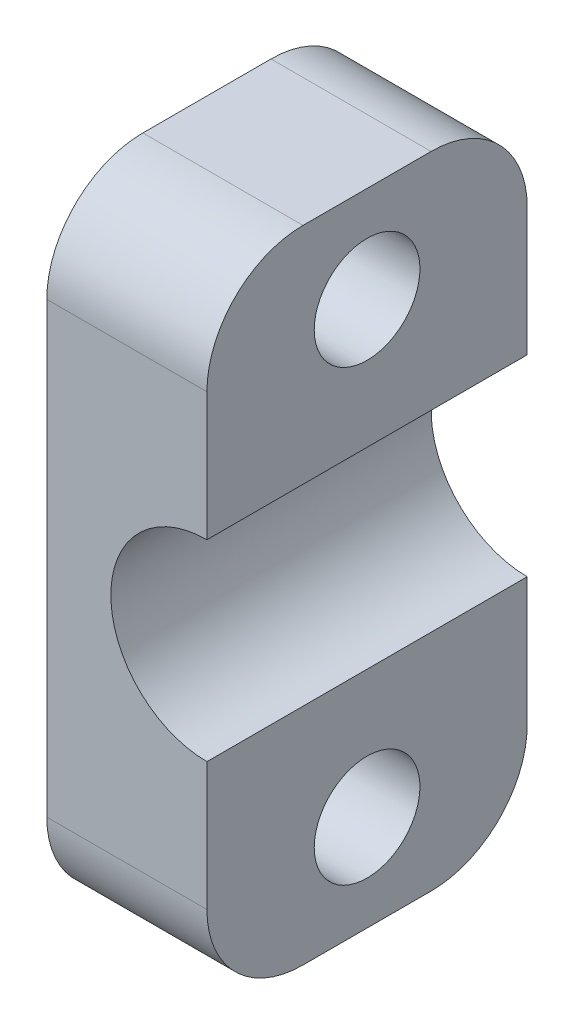
from build123d import *

# Parameters (mm, degrees)
SKETCH_1_W          = 10
SKETCH_1_H          = 20
SKETCH_1_R          = 3
EXTRUDE_1_DEPTH     = 10
SKETCH_2_R          = 1.65
CUT_EXTRUDE_1_DEPTH = 18.320508076
SKETCH_3_W          = 12.852703923
SKETCH_3_H          = 20.2795508
CUT_EXTRUDE_2_DEPTH = 16
FILLET_1_R          = 3


with BuildPart() as part:
    # 草圖1 → 填料-伸長1 (new body)
    with BuildSketch(Plane.XY):
        Rectangle(SKETCH_1_W, SKETCH_1_H)
        Circle(SKETCH_1_R, mode=Mode.SUBTRACT)
    extrude(amount=EXTRUDE_1_DEPTH)

    # 草圖2 → 除料-伸長1 (cut, through all)
    with BuildSketch(Plane.ZY.offset(5)):
        with Locations((5, 7)):
            Circle(SKETCH_2_R)
        with Locations((5, -7)):
            Circle(SKETCH_2_R)
    extrude(amount=-CUT_EXTRUDE_1_DEPTH, mode=Mode.SUBTRACT)

    # 草圖3 → 除料-伸長2 (cut, through all)
    with BuildSketch(Plane.XY.offset(10)):
        with Locations((6.426351961, -0.1397754)):
            Rectangle(SKETCH_3_W, SKETCH_3_H)
    extrude(amount=-CUT_EXTRUDE_2_DEPTH, mode=Mode.SUBTRACT)

    # 圓角1
    fillet_1_edges = [part.edges().sort_by_distance(p)[0] for p in [
        (-2.5, 10, 0),
        (-2.5, 10, 10),
        (-2.5, -10, 0),
        (-2.5, -10, 10),
    ]]
    fillet(fillet_1_edges, radius=FILLET_1_R)


solid = part.part
